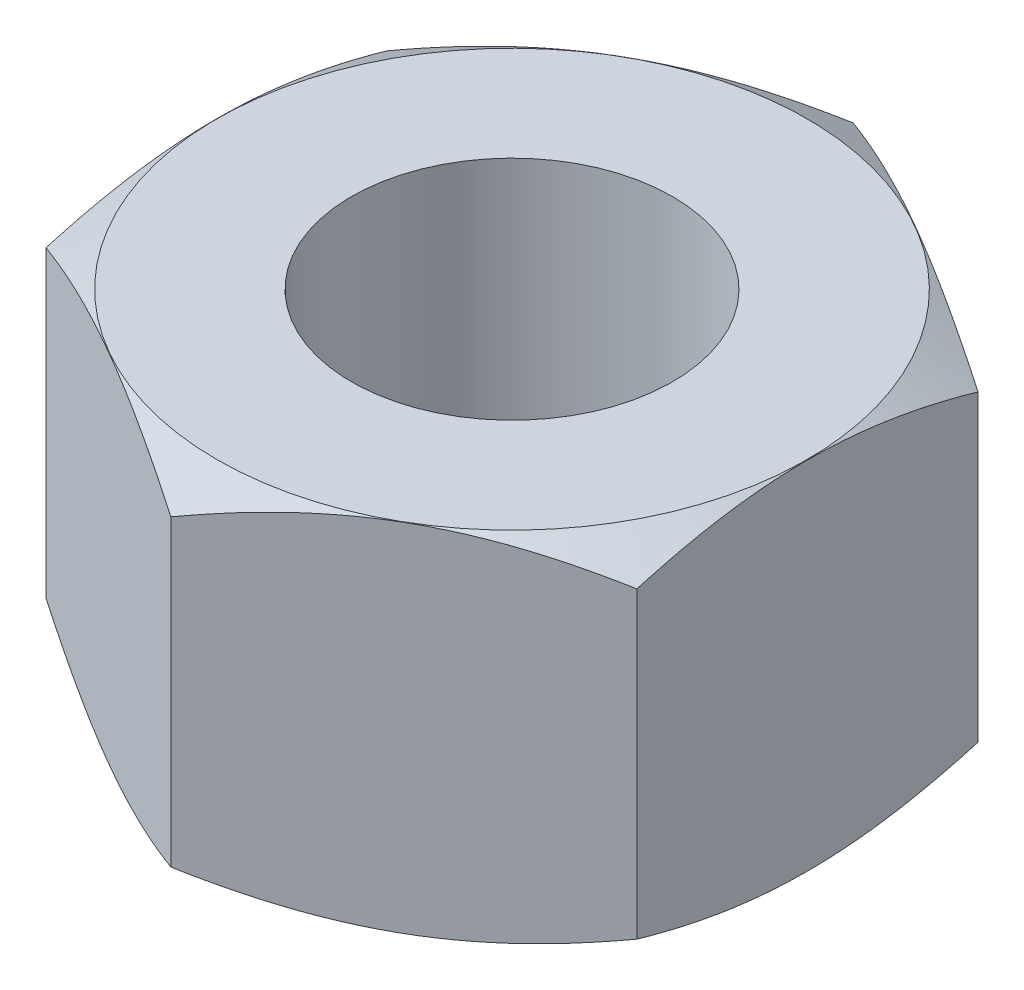
from build123d import *
from OCP.BRepFilletAPI import BRepFilletAPI_MakeChamfer

# Parameters (mm, degrees)
SZKIC1_W                   = 4.712
SZKIC1_H                   = 9.3
SFAZOWANIE1_SIZE           = 1.2
SFAZOWANIE1_SIZE2          = 0.692820323
SZKIC2_OUTSIDE_W           = 25.168
SZKIC2_OUTSIDE_H           = 25.168
WYTNIJ_WYCI_GNI_CIE1_DEPTH = 16.649600634


with BuildPart() as part:
    # Szkic1 → Obrót1 (revolve)
    with BuildSketch(Plane.XY, mode=Mode.PRIVATE) as obr_t1_sk:
        with Locations((6.544, 4.65)):
            Rectangle(SZKIC1_W, SZKIC1_H)
    revolve(obr_t1_sk.sketch.rotate(Axis((0, 0, 0), (0, 1, 0)), 90), axis=Axis((0, 0, 0), (0, 1, 0)))

    # Sfazowanie1: one chamfer whose edges measure the first distance from different faces: ONE call of the kernel's chamfer builder (chamfer() names one face for all edges)
    sfazowanie1_edges_1 = [part.edges().sort_by_distance(p)[0] for p in [
        (0, 0, 8.9),
    ]]
    sfazowanie1_side_1 = [part.faces().sort_by_distance(p)[0] for p in [
        (0, 0, 4.439730014),
    ]]
    sfazowanie1_edges_2 = [part.edges().sort_by_distance(p)[0] for p in [
        (0, 9.3, 8.9),
    ]]
    sfazowanie1_side_2 = [part.faces().sort_by_distance(p)[0] for p in [
        (0, 9.3, 8.648269986),
    ]]
    sfazowanie1 = BRepFilletAPI_MakeChamfer(part.part.solid().wrapped)
    for e in sfazowanie1_edges_1:
        sfazowanie1.Add(SFAZOWANIE1_SIZE, SFAZOWANIE1_SIZE2, e.wrapped, sfazowanie1_side_1[0].wrapped)  # the first distance lies on this face
    for e in sfazowanie1_edges_2:
        sfazowanie1.Add(SFAZOWANIE1_SIZE, SFAZOWANIE1_SIZE2, e.wrapped, sfazowanie1_side_2[0].wrapped)  # the first distance lies on this face
    add(Compound.cast(sfazowanie1.Shape()), mode=Mode.REPLACE)

    # Szkic2 outside → Wytnij-wyciągnięcie1 (cut, through all)
    with BuildSketch(Plane(origin=(0, 9.3, 0), x_dir=(1, 0, 0), z_dir=(0, 1, 0))):
        Rectangle(SZKIC2_OUTSIDE_W, SZKIC2_OUTSIDE_H)
        Polygon((7.707626094, 4.45), (0, 8.9), (-7.707626094, 4.45), (-7.707626094, -4.45), (0, -8.9), (7.707626094, -4.45), align=None, mode=Mode.SUBTRACT)
    extrude(amount=-WYTNIJ_WYCI_GNI_CIE1_DEPTH, mode=Mode.SUBTRACT)


solid = part.part
